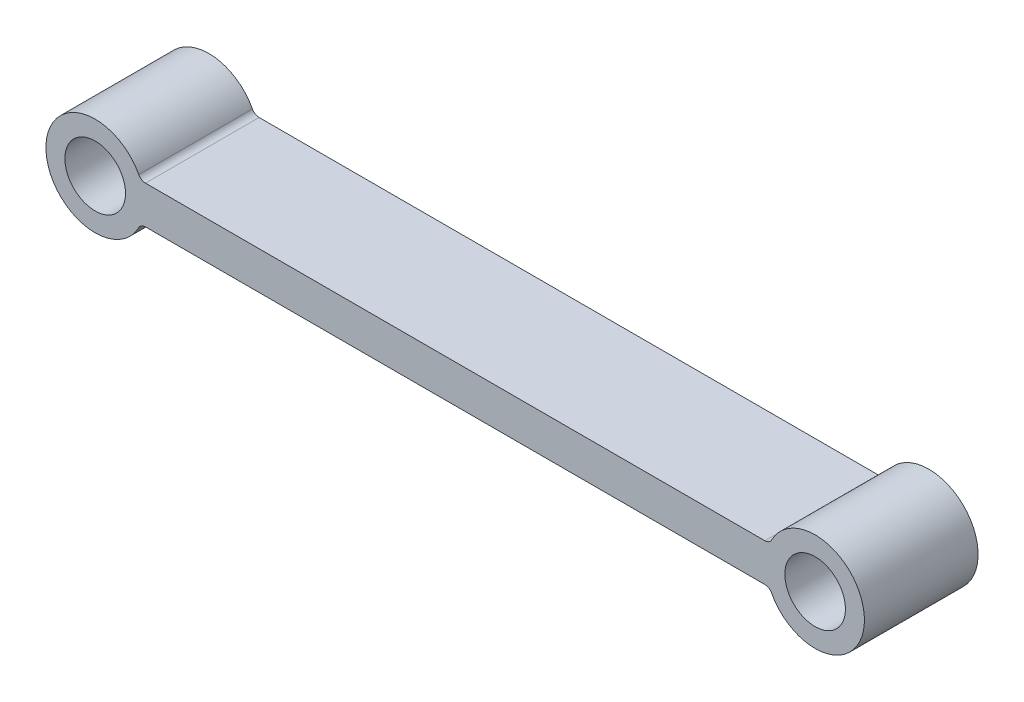
from build123d import *

# Parameters (mm, degrees)
SKETCH1_R           = 4
BOSS_EXTRUDE1_DEPTH = 15


with BuildPart() as part:
    # Sketch1 → Boss-Extrude1 (new body)
    with BuildSketch(Plane.XY):
        with BuildLine():
            Line((-40.866750419, 2.5), (40.866750419, 2.5))
            ThreePointArc((40.866750419, 2.5), (41.383148199, 2.643651161), (41.751183697, 3.033333333))
            ThreePointArc((41.751183697, 3.033333333), (54, 0), (41.751183697, -3.033333333))
            ThreePointArc((41.751183697, -3.033333333), (41.383148199, -2.643651161), (40.866750419, -2.5))
            Line((40.866750419, -2.5), (-40.866750419, -2.5))
            ThreePointArc((-40.866750419, -2.5), (-41.383148199, -2.643651161), (-41.751183697, -3.033333333))
            ThreePointArc((-41.751183697, -3.033333333), (-54, 0), (-41.751183697, 3.033333333))
            ThreePointArc((-41.751183697, 3.033333333), (-41.383148199, 2.643651161), (-40.866750419, 2.5))
        make_face()
        with Locations((-47.5, 0)):
            Circle(SKETCH1_R, mode=Mode.SUBTRACT)
        with Locations(Location((47.5, 0, 0), (0, 0, 180))):
            Circle(SKETCH1_R, mode=Mode.SUBTRACT)
    extrude(amount=BOSS_EXTRUDE1_DEPTH)


solid = part.part
